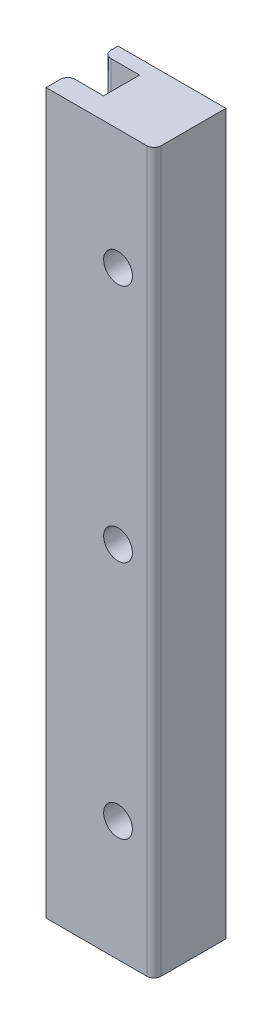
from build123d import *

# Parameters (mm, degrees)
BOSS_EXTRUDE1_DEPTH = 100
FILLET1_R           = 1
SKETCH2_R           = 2
CUT_EXTRUDE1_DEPTH  = 10


with BuildPart() as part:
    # Sketch1 → Boss-Extrude1 (new body)
    with BuildSketch(Plane(origin=(0, 0, 0), x_dir=(1, 0, 0), z_dir=(0, 1, 0))):
        Polygon((0, 0), (15, 0), (15, -2), (15, -10), (7, -10), (0, -10), (0, -7), (5, -7), (5, -2), (0, -2), align=None)
    extrude(amount=BOSS_EXTRUDE1_DEPTH)

    # Fillet1
    fillet1_edges = [part.edges().sort_by_distance(p)[0] for p in [
        (15, 50, 10),
        (0, 50, 7),
        (0, 50, 2),
    ]]
    fillet(fillet1_edges, radius=FILLET1_R)

    # Sketch2 → Cut-Extrude1 (cut)
    with BuildSketch(Plane.XY.offset(10)):
        with Locations((10, 16.7)):
            Circle(SKETCH2_R)
        with Locations((10, 83.3)):
            Circle(SKETCH2_R)
        with Locations((10, 50)):
            Circle(SKETCH2_R)
    extrude(amount=-CUT_EXTRUDE1_DEPTH, mode=Mode.SUBTRACT)


solid = part.part
